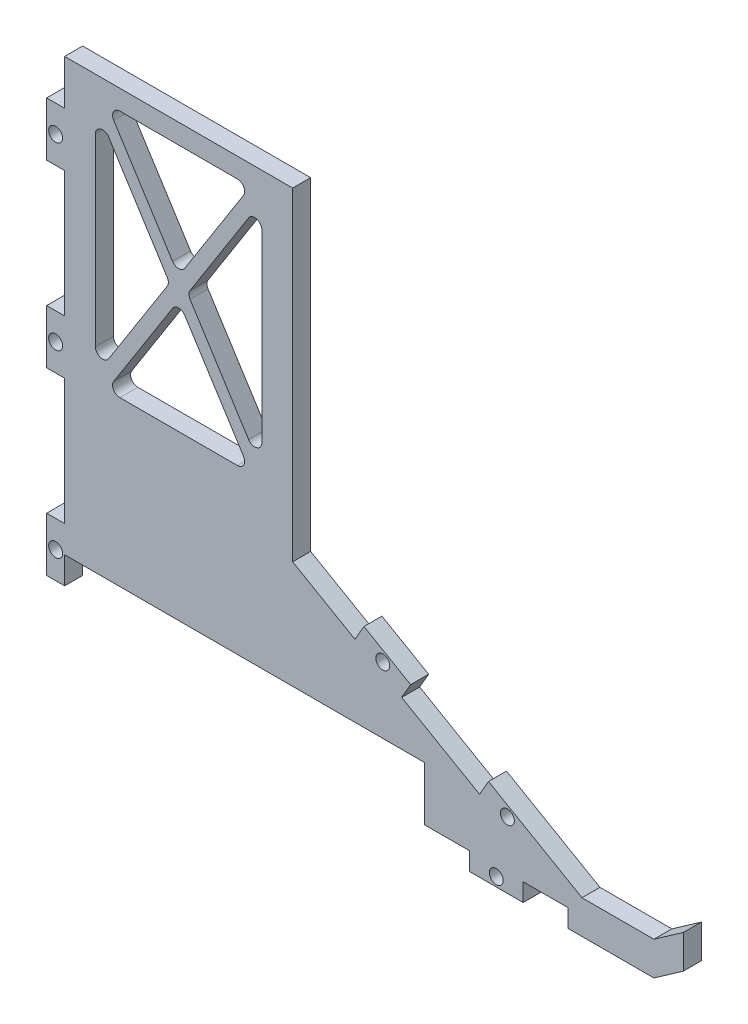
from build123d import *

# Parameters (mm, degrees)
BOSS_EXTRUDE1_DEPTH          = 6.35
SKETCH2_W                    = 127
SKETCH2_H                    = 19.05
CUT_EXTRUDE1_DEPTH           = 195.543611155
SKETCH3_W                    = 86.864773719
SKETCH3_H                    = 114.3
BOSS_EXTRUDE2_DEPTH          = 6.35
SKETCH4_W                    = 6.35
SKETCH4_H                    = 9.525
SKETCH4_H_2                  = 44.45
SKETCH4_H_3                  = 15.875
CUT_EXTRUDE2_DEPTH           = 253.93516292
SKETCH5_W                    = 19.05
SKETCH5_H                    = 6.35
BOSS_EXTRUDE3_DEPTH          = 6.35
BOSS_EXTRUDE4_DEPTH          = 6.35
LPATTERN1_COUNT              = 2
LPATTERN1_PITCH              = 50.8
F_10_0_1935_DIAMETER_HOLE1_D = 4.9149
F_10_0_1935_DIAMETER_HOLE2_D = 4.9149
BOSS_EXTRUDE8_DEPTH          = 6.35
CUT_EXTRUDE4_DEPTH           = 283.81411342
FILLET1_R                    = 2.54


with BuildPart() as part:
    # Sketch1 → Boss-Extrude1 (new body)
    with BuildSketch(Plane.XY):
        Polygon((86.864773719, 57.15), (185.851477372, 0), (86.864773719, 0), (0, 0), (0, 57.15), align=None)
    extrude(amount=BOSS_EXTRUDE1_DEPTH)

    # Sketch2 → Cut-Extrude1 (cut, through all)
    with BuildSketch(Plane.XY.offset(6.35)):
        with Locations((69.85, 9.525)):
            Rectangle(SKETCH2_W, SKETCH2_H)
    extrude(amount=-CUT_EXTRUDE1_DEPTH, mode=Mode.SUBTRACT)

    # Sketch3 → Boss-Extrude2 (add)
    with BuildSketch(Plane.XY.offset(6.35)):
        with Locations((43.432386859, 114.3)):
            Rectangle(SKETCH3_W, SKETCH3_H)
    extrude(amount=-BOSS_EXTRUDE2_DEPTH)

    # Sketch4 → Cut-Extrude2 (cut, through all)
    with BuildSketch(Plane.XY.offset(6.35)):
        with Locations((3.175, 4.7625)):
            Rectangle(SKETCH4_W, SKETCH4_H)
        with Locations((3.175, 50.8)):
            Rectangle(SKETCH4_W, SKETCH4_H_2)
        with Locations((3.175, 114.3)):
            Rectangle(SKETCH4_W, SKETCH4_H_2)
        with Locations((3.175, 163.5125)):
            Rectangle(SKETCH4_W, SKETCH4_H_3)
    extrude(amount=-CUT_EXTRUDE2_DEPTH, mode=Mode.SUBTRACT)

    # Sketch5 → Boss-Extrude3 (add)
    with BuildSketch(Plane.XY.offset(6.35)):
        with Locations((158.75, -3.175)):
            Rectangle(SKETCH5_W, SKETCH5_H)
    extrude(amount=-BOSS_EXTRUDE3_DEPTH)

    # Sketch6 → Boss-Extrude4 (add)
    with BuildSketch(Plane.XY.offset(6.35)):
        Polygon((108.861818976, 44.45), (125.359602918, 34.925), (128.534602918, 40.424261314), (112.036818976, 49.949261314), align=None)
    boss_extrude4 = extrude(amount=-BOSS_EXTRUDE4_DEPTH)

    # LPattern1: Boss-Extrude4 ×2
    with Locations(*[Vector(0.8660254037844415, -0.49999999999999517, 0) * (i * LPATTERN1_PITCH) for i in range(1, LPATTERN1_COUNT)]):
        add(boss_extrude4)

    # #10 (0.1935) Diameter Hole1 (through all)
    with Locations(Plane.XY.offset(6.35)):
        with Locations((3.175, 146.05), (3.175, 82.55), (3.175, 19.05)):
            Hole(F_10_0_1935_DIAMETER_HOLE1_D / 2)

    # #10 (0.1935) Diameter Hole2 (through all)
    with Locations(Plane.XY.offset(6.35)):
        with Locations((118.698210947, 42.437130657), (162.692301459, 17.037130657), (158.75, -3.175)):
            Hole(F_10_0_1935_DIAMETER_HOLE2_D / 2)

    # Sketch20 → Boss-Extrude8 (add)
    with BuildSketch(Plane.XY.offset(6.35)):
        Polygon((172.52869343, 15.024261314), (189.026477372, 5.499261314), (214.426477372, 5.499261314), (224.829708334, 12.783682056), (224.829708334, 0.934420742), (214.426477372, -6.35), (185.851477372, -6.35), (184.15, -6.35), (184.15, 0), (185.851477372, 0), (169.35369343, 9.525), align=None)
    extrude(amount=-BOSS_EXTRUDE8_DEPTH)

    # Sketch22 → Cut-Extrude4 (cut, through all)
    with BuildSketch(Plane.XY.offset(6.35)):
        Polygon((17.220652064, 161.925), (17.220652064, 79.375), (43.43238686, 120.65), align=None)
        Polygon((75.994121656, 79.375), (49.78238686, 120.65), (75.994121656, 161.925), align=None)
        Polygon((21.20738686, 164.45678038), (46.60738686, 124.46), (72.00738686, 164.45678038), align=None)
        Polygon((46.60738686, 116.84), (72.00738686, 76.84321962), (21.20738686, 76.84321962), align=None)
    extrude(amount=-CUT_EXTRUDE4_DEPTH, mode=Mode.SUBTRACT)

    # Fillet1
    fillet1_edges = [part.edges().sort_by_distance(p)[0] for p in [
        (17.220652064, 161.925, 3.175),
        (43.43238686, 120.65, 3.175),
        (17.220652064, 79.375, 3.175),
        (75.994121656, 161.925, 3.175),
        (75.994121656, 79.375, 3.175),
        (49.78238686, 120.65, 3.175),
        (21.20738686, 164.45678038, 3.175),
        (72.00738686, 164.45678038, 3.175),
        (46.60738686, 124.46, 3.175),
        (21.20738686, 76.84321962, 3.175),
        (46.60738686, 116.84, 3.175),
        (72.00738686, 76.84321962, 3.175),
    ]]
    fillet(fillet1_edges, radius=FILLET1_R)


solid = part.part
